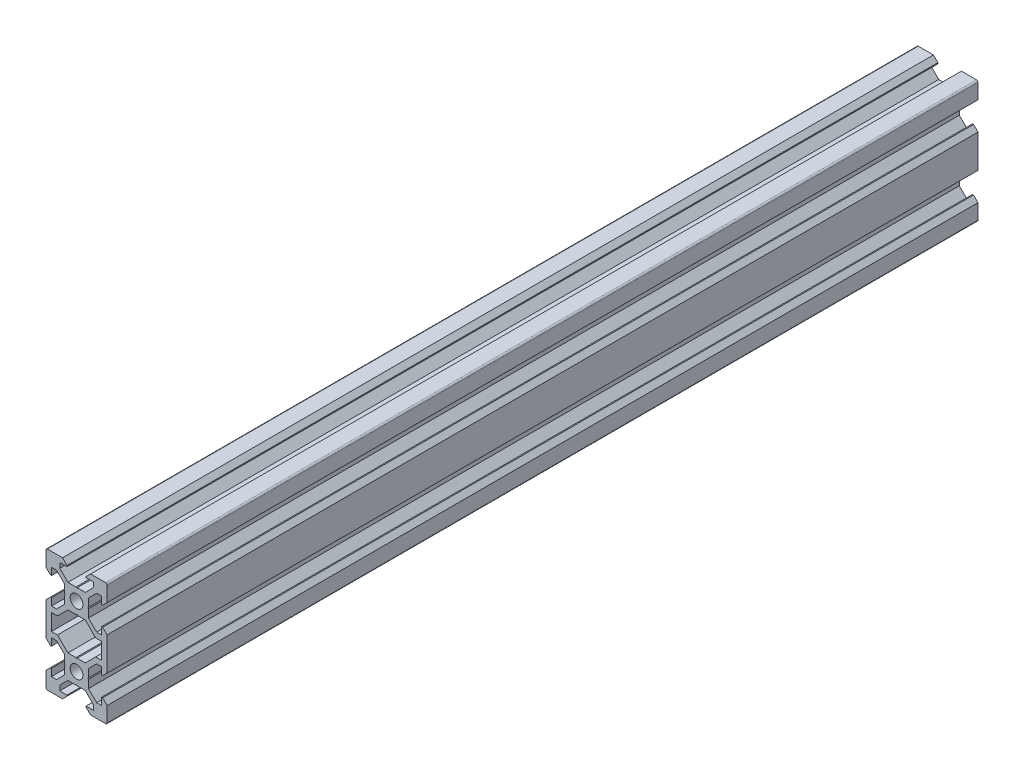
from build123d import *
from build123d.topology import SkipClean

# Parameters (mm, degrees)
BOSS_EXTRU_1_DEPTH     = 285
SYM_TRIE6_COPY_1_DEPTH = 285


with BuildPart() as part:
    # Esquisse1 → Boss.-Extru.1 (new body)
    with BuildSketch(Plane.XY):
        with BuildLine():
            Line((-9.5, 10), (-4.58, 10))
            Line((-4.58, 10), (-3.125, 8.545))
            Line((-3.125, 8.545), (-3.125, 8.2))
            Line((-3.125, 8.2), (-5.5, 8.2))
            Line((-5.5, 8.2), (-5.5, 6.560660172))
            Line((-5.5, 6.560660172), (-2.839339828, 3.9))
            Line((-2.839339828, 3.9), (-0.21, 3.9))
            Line((-0.21, 3.9), (0, 3.69))
            Line((0, 3.69), (0, 2.1))
            ThreePointArc((0, 2.1), (-2.1, 0), (0, -2.1))
            Line((0, -2.1), (0, -3.69))
            Line((0, -3.69), (-0.21, -3.9))
            Line((-0.21, -3.9), (-2.839339828, -3.9))
            Line((-2.839339828, -3.9), (-6.239339828, -7.3))
            Line((-6.239339828, -7.3), (-8.2, -7.3))
            Line((-8.2, -7.3), (-8.2, -10))
            Line((-8.2, -10), (-10, -10))
            Line((-10, -10), (-10, -4.58))
            Line((-10, -4.58), (-8.545, -3.125))
            Line((-8.545, -3.125), (-8.2, -3.125))
            Line((-8.2, -3.125), (-8.2, -5.5))
            Line((-8.2, -5.5), (-6.560660172, -5.5))
            Line((-6.560660172, -5.5), (-3.9, -2.839339828))
            Line((-3.9, -2.839339828), (-3.9, -0.21))
            Line((-3.9, -0.21), (-3.69, 0))
            Line((-3.69, 0), (-3.9, 0.21))
            Line((-3.9, 0.21), (-3.9, 2.839339828))
            Line((-3.9, 2.839339828), (-6.560660172, 5.5))
            Line((-6.560660172, 5.5), (-8.2, 5.5))
            Line((-8.2, 5.5), (-8.2, 3.125))
            Line((-8.2, 3.125), (-8.545, 3.125))
            Line((-8.545, 3.125), (-10, 4.58))
            Line((-10, 4.58), (-10, 9.5))
            ThreePointArc((-10, 9.5), (-9.853553391, 9.853553391), (-9.5, 10))
        make_face()
    boss_extru_1 = extrude(amount=BOSS_EXTRU_1_DEPTH)

    # Symétrie1: Boss.-Extru.1 across plane
    add(boss_extru_1.mirror(Plane(origin=(0, 3.69, 285), x_dir=(0, 0, 1), z_dir=(-1, 0, 0))))

    # Symétrie6: Boss.-Extru.1 across plane
    add(boss_extru_1.mirror(Plane(origin=(-8.2, -10, 285), x_dir=(0, 0, 1), z_dir=(0, 1, 0))))

    # Symétrie6 copy 1 sketch → Symétrie6 copy 1 (add)
    with SkipClean():  # the faces are left unmerged after this step: merging them gives an invalid solid
        with BuildSketch(Plane(origin=(0, -20, 0), x_dir=(-1, 0, 0), z_dir=(0, 0, 1))):
            with BuildLine():
                Line((-9.5, 10), (-4.58, 10))
                Line((-4.58, 10), (-3.125, 8.545))
                Line((-3.125, 8.545), (-3.125, 8.2))
                Line((-3.125, 8.2), (-5.5, 8.2))
                Line((-5.5, 8.2), (-5.5, 6.560660172))
                Line((-5.5, 6.560660172), (-2.839339828, 3.9))
                Line((-2.839339828, 3.9), (-0.21, 3.9))
                Line((-0.21, 3.9), (0, 3.69))
                Line((0, 3.69), (0, 2.1))
                ThreePointArc((0, 2.1), (-2.1, 0), (0, -2.1))
                Line((0, -2.1), (0, -3.69))
                Line((0, -3.69), (-0.21, -3.9))
                Line((-0.21, -3.9), (-2.839339828, -3.9))
                Line((-2.839339828, -3.9), (-6.239339828, -7.3))
                Line((-6.239339828, -7.3), (-8.2, -7.3))
                Line((-8.2, -7.3), (-8.2, -10))
                Line((-8.2, -10), (-10, -10))
                Line((-10, -10), (-10, -4.58))
                Line((-10, -4.58), (-8.545, -3.125))
                Line((-8.545, -3.125), (-8.2, -3.125))
                Line((-8.2, -3.125), (-8.2, -5.5))
                Line((-8.2, -5.5), (-6.560660172, -5.5))
                Line((-6.560660172, -5.5), (-3.9, -2.839339828))
                Line((-3.9, -2.839339828), (-3.9, -0.21))
                Line((-3.9, -0.21), (-3.69, 0))
                Line((-3.69, 0), (-3.9, 0.21))
                Line((-3.9, 0.21), (-3.9, 2.839339828))
                Line((-3.9, 2.839339828), (-6.560660172, 5.5))
                Line((-6.560660172, 5.5), (-8.2, 5.5))
                Line((-8.2, 5.5), (-8.2, 3.125))
                Line((-8.2, 3.125), (-8.545, 3.125))
                Line((-8.545, 3.125), (-10, 4.58))
                Line((-10, 4.58), (-10, 9.5))
                ThreePointArc((-10, 9.5), (-9.853553391, 9.853553391), (-9.5, 10))
            make_face()
        extrude(amount=SYM_TRIE6_COPY_1_DEPTH)


solid = part.part
